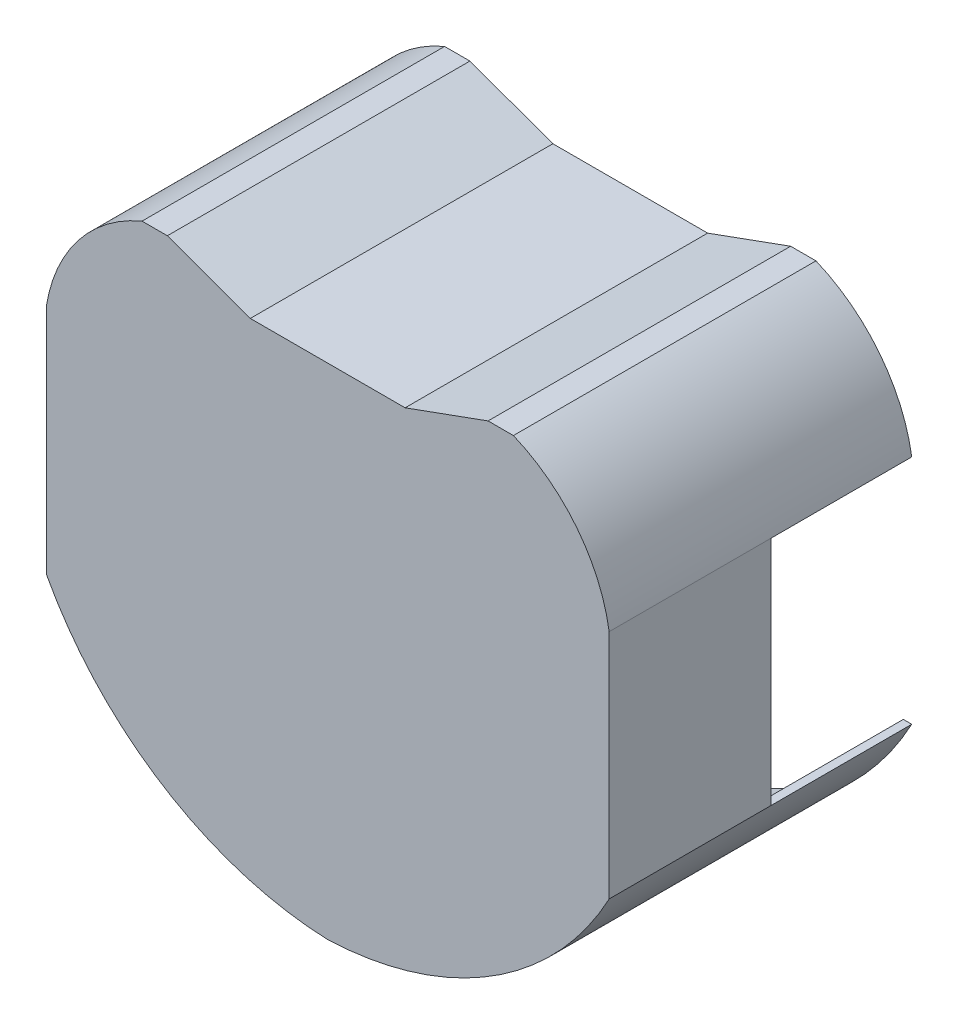
from build123d import *

# Parameters (mm, degrees)
BOSS_EXTRUDE1_DEPTH = 20
BOSS_EXTRUDE2_START = 20
BOSS_EXTRUDE2_DEPTH = 20
BOSS_EXTRUDE3_DEPTH = 3


with BuildPart() as part:
    # Sketch1 → Boss-Extrude1 (new body)
    with BuildSketch(Plane.XY):
        with BuildLine():
            Line((-39.43013831, -13.342220693), (-39.43013831, 19.556376021))
            ThreePointArc((-39.43013831, 19.556376021), (-34.879077983, 29.991705983), (-25.8204651, 36.88734186))
            Line((-25.8204651, 36.88734186), (-22.2204651, 36.88734186))
            Line((-22.2204651, 36.88734186), (-10.430426389, 32.607077664))
            Line((-10.430426389, 32.607077664), (11.569573611, 32.607077664))
            Line((11.569573611, 32.607077664), (23.359612322, 36.88734186))
            Line((23.359612322, 36.88734186), (26.959612322, 36.88734186))
            ThreePointArc((26.959612322, 36.88734186), (36.018225205, 29.991705983), (40.569285532, 19.556376021))
            Line((40.569285532, 19.556376021), (40.569285532, -13.342220693))
            ThreePointArc((40.569285532, -13.342220693), (23.896981794, -31.168666499), (0.569573611, -38.350581945))
            ThreePointArc((0.569573611, -38.350581945), (-22.757834572, -31.168666499), (-39.43013831, -13.342220693))
        make_face()
        with BuildLine():
            Line((-38.23013831, 19.556376021), (-38.23013831, -13.342220693))
            ThreePointArc((-38.23013831, -13.342220693), (-21.933714077, -29.946069187), (0.569573611, -35.850581945))
            ThreePointArc((0.569573611, -35.850581945), (23.072861298, -29.946069187), (39.369285532, -13.342220693))
            Line((39.369285532, -13.342220693), (39.369285532, 19.556376021))
            ThreePointArc((39.369285532, 19.556376021), (34.750379485, 28.298871636), (26.959612322, 34.38734186))
            Line((26.959612322, 34.38734186), (23.359612322, 34.38734186))
            Line((23.359612322, 34.38734186), (11.569573611, 30.107077664))
            Line((11.569573611, 30.107077664), (-10.430426389, 30.107077664))
            Line((-10.430426389, 30.107077664), (-22.2204651, 34.38734186))
            Line((-22.2204651, 34.38734186), (-25.8204651, 34.38734186))
            ThreePointArc((-25.8204651, 34.38734186), (-33.611232263, 28.298871636), (-38.23013831, 19.556376021))
        make_face(mode=Mode.SUBTRACT)
    extrude(amount=BOSS_EXTRUDE1_DEPTH)

    # Sketch2 → Boss-Extrude2 (add)
    with BuildSketch(Plane(origin=(0, 0, 0), x_dir=(-1, 0, 0), z_dir=(0, 0, -1)).offset(BOSS_EXTRUDE2_START)):
        with BuildLine():
            ThreePointArc((-26.959612322, 36.88734186), (-36.018225205, 29.991705983), (-40.569285532, 19.556376021))
            Line((-40.569285532, 19.556376021), (-39.369285532, 19.556376021))
            ThreePointArc((-39.369285532, 19.556376021), (-34.750379485, 28.298871636), (-26.959612322, 34.38734186))
            Line((-26.959612322, 34.38734186), (-23.359612322, 34.38734186))
            Line((-23.359612322, 34.38734186), (-11.569573611, 30.107077664))
            Line((-11.569573611, 30.107077664), (-0.569573611, 30.107077664))
            Line((-0.569573611, 30.107077664), (-0.569573611, 32.607077664))
            Line((-0.569573611, 32.607077664), (-11.569573611, 32.607077664))
            Line((-11.569573611, 32.607077664), (-23.359612322, 36.88734186))
            Line((-23.359612322, 36.88734186), (-26.959612322, 36.88734186))
        make_face()
        with BuildLine():
            Line((10.430426389, 32.607077664), (-0.569573611, 32.607077664))
            Line((-0.569573611, 32.607077664), (-0.569573611, 30.107077664))
            Line((-0.569573611, 30.107077664), (10.430426389, 30.107077664))
            Line((10.430426389, 30.107077664), (22.2204651, 34.38734186))
            Line((22.2204651, 34.38734186), (25.8204651, 34.38734186))
            ThreePointArc((25.8204651, 34.38734186), (33.611232263, 28.298871636), (38.23013831, 19.556376021))
            Line((38.23013831, 19.556376021), (39.43013831, 19.556376021))
            ThreePointArc((39.43013831, 19.556376021), (34.879077983, 29.991705983), (25.8204651, 36.88734186))
            Line((25.8204651, 36.88734186), (22.2204651, 36.88734186))
            Line((22.2204651, 36.88734186), (10.430426389, 32.607077664))
        make_face()
        with BuildLine():
            Line((-0.569573611, -38.350581945), (-0.569573611, -35.850581945))
            ThreePointArc((-0.569573611, -35.850581945), (-23.072861298, -29.946069187), (-39.369285532, -13.342220693))
            Line((-39.369285532, -13.342220693), (-40.569285532, -13.342220693))
            ThreePointArc((-40.569285532, -13.342220693), (-23.896981794, -31.168666499), (-0.569573611, -38.350581945))
        make_face()
        with BuildLine():
            Line((-0.569573611, -38.350581945), (-0.569573611, -35.850581945))
            ThreePointArc((-0.569573611, -35.850581945), (21.933714077, -29.946069187), (38.23013831, -13.342220693))
            Line((38.23013831, -13.342220693), (39.43013831, -13.342220693))
            ThreePointArc((39.43013831, -13.342220693), (22.757834572, -31.168666499), (-0.569573611, -38.350581945))
        make_face()
    extrude(amount=-BOSS_EXTRUDE2_DEPTH)

    # Sketch3 → Boss-Extrude3 (add)
    with BuildSketch(Plane.XY.offset(20)):
        with BuildLine():
            Line((-25.8204651, 36.88734186), (-22.2204651, 36.88734186))
            Line((-22.2204651, 36.88734186), (-10.430426389, 32.607077664))
            Line((-10.430426389, 32.607077664), (11.569573611, 32.607077664))
            Line((11.569573611, 32.607077664), (23.359612322, 36.88734186))
            Line((23.359612322, 36.88734186), (26.959612322, 36.88734186))
            ThreePointArc((26.959612322, 36.88734186), (36.018225205, 29.991705983), (40.569285532, 19.556376021))
            Line((40.569285532, 19.556376021), (40.569285532, -13.342220693))
            ThreePointArc((40.569285532, -13.342220693), (23.896981794, -31.168666499), (0.569573611, -38.350581945))
            ThreePointArc((0.569573611, -38.350581945), (-22.757834572, -31.168666499), (-39.43013831, -13.342220693))
            Line((-39.43013831, -13.342220693), (-39.43013831, 19.556376021))
            ThreePointArc((-39.43013831, 19.556376021), (-34.879077983, 29.991705983), (-25.8204651, 36.88734186))
        make_face()
    extrude(amount=BOSS_EXTRUDE3_DEPTH)


solid = part.part
